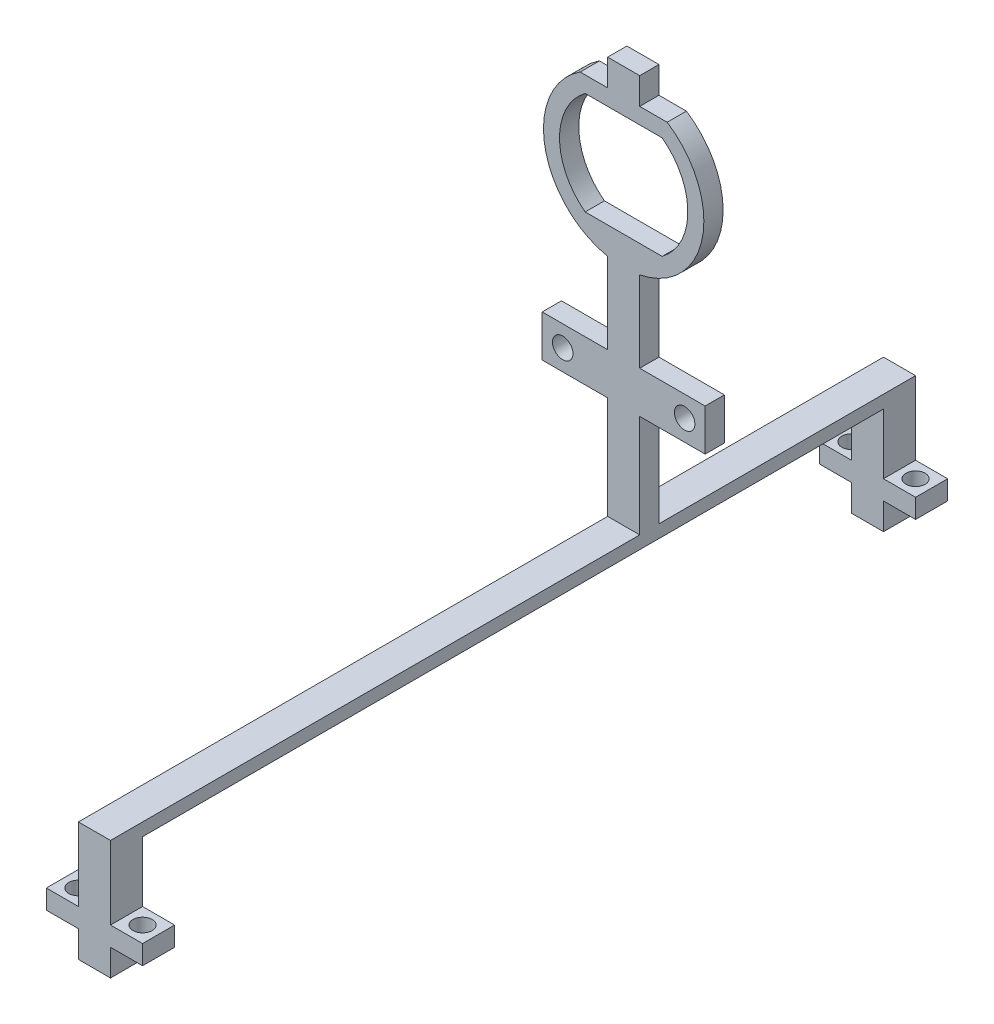
from build123d import *

# Parameters (mm, degrees)
BOSS_EXTRUDE1_DEPTH     = 3
SKETCH3_W               = 25.4
SKETCH3_H               = 6.5
SKETCH3_R               = 1.6
BOSS_EXTRUDE4_DEPTH     = 3
SKETCH11_W              = 5
SKETCH11_H              = 3
BOSS_EXTRUDE8_DEPTH     = 4.15
SKETCH6_W               = 5
SKETCH6_H               = 2
BOSS_EXTRUDE5_DEPTH     = 40
SKETCH10_W              = 5
SKETCH10_H              = 2
BOSS_EXTRUDE7_DEPTH     = 82.49
BOSS_EXTRUDE9_DEPTH     = 5
SKETCH15_R              = 1.5
CUT_EXTRUDE1_DEPTH      = 5
MIRROR2_COPY_1_SKETCH_R = 1.5
MIRROR2_COPY_1_DEPTH    = 5


with BuildPart() as part:
    # Sketch1 → Boss-Extrude1 (new body)
    with BuildSketch(Plane.XY):
        with BuildLine():
            Line((2.5, -49.347448714), (2.5, -12.247448714))
            ThreePointArc((2.5, -12.247448714), (12.284218259, -2.312570382), (6.782329983, 10.5))
            Line((6.782329983, 10.5), (-6.782329983, 10.5))
            ThreePointArc((-6.782329983, 10.5), (-12.284218259, -2.312570382), (-2.5, -12.247448714))
            Line((-2.5, -12.247448714), (-2.5, -49.347448714))
            Line((-2.5, -49.347448714), (2.5, -49.347448714))
        make_face()
        with BuildLine():
            Line((-6, -8), (6, -8))
            ThreePointArc((6, -8), (10, 0), (6, 8))
            Line((6, 8), (-6, 8))
            ThreePointArc((-6, 8), (-10, 0), (-6, -8))
        make_face(mode=Mode.SUBTRACT)
    extrude(amount=BOSS_EXTRUDE1_DEPTH)

    # Sketch3 → Boss-Extrude4 (add)
    with BuildSketch(Plane.XY):
        with Locations((0, -28.097448714)):
            Rectangle(SKETCH3_W, SKETCH3_H)
        with Locations((-9.5, -28.097448714)):
            Circle(SKETCH3_R, mode=Mode.SUBTRACT)
        with Locations(Location((9.5, -28.097448714, 0), (0, 0, 180))):
            Circle(SKETCH3_R, mode=Mode.SUBTRACT)
    extrude(amount=BOSS_EXTRUDE4_DEPTH)

    # Sketch11 → Boss-Extrude8 (add)
    with BuildSketch(Plane(origin=(0, 10.5, 0), x_dir=(1, 0, 0), z_dir=(0, 1, 0))):
        with Locations((0, -1.5)):
            Rectangle(SKETCH11_W, SKETCH11_H)
    extrude(amount=BOSS_EXTRUDE8_DEPTH)

    # Sketch6 → Boss-Extrude5 (add)
    with BuildSketch(Plane(origin=(0, 0, 0), x_dir=(-1, 0, 0), z_dir=(0, 0, -1))):
        with Locations((0, -48.347448714)):
            Rectangle(SKETCH6_W, SKETCH6_H)
    extrude(amount=BOSS_EXTRUDE5_DEPTH)

    # Sketch10 → Boss-Extrude7 (add)
    with BuildSketch(Plane.XY.offset(3)):
        with Locations((0, -48.347448714)):
            Rectangle(SKETCH10_W, SKETCH10_H)
    extrude(amount=BOSS_EXTRUDE7_DEPTH)

    # Sketch14 → Boss-Extrude9 (add)
    with BuildSketch(Plane(origin=(0, 0, -40), x_dir=(-1, 0, 0), z_dir=(0, 0, -1))):
        Polygon((-2.5, -61.767448714), (-2.5, -65.917448714), (2.5, -65.917448714), (2.5, -61.767448714), (7.5, -61.767448714), (7.5, -58.767448714), (2.5, -58.767448714), (2.5, -49.347448714), (-2.5, -49.347448714), (-2.5, -58.767448714), (-7.5, -58.767448714), (-7.5, -61.767448714), align=None)
    boss_extrude9 = extrude(amount=-BOSS_EXTRUDE9_DEPTH)

    # Sketch15 → Cut-Extrude1 (cut)
    with BuildSketch(Plane(origin=(0, -58.767448714, 0), x_dir=(1, 0, 0), z_dir=(0, 1, 0))):
        with Locations(Location((-5, 37.5, 0), (0, 0, 270))):
            Circle(SKETCH15_R)
    cut_extrude1 = extrude(amount=-CUT_EXTRUDE1_DEPTH, mode=Mode.SUBTRACT)

    # Mirror1: Cut-Extrude1 across plane
    add(cut_extrude1.mirror(Plane(origin=(0, 0, 0), x_dir=(0, 0, 1), z_dir=(1, 0, 0))), mode=Mode.SUBTRACT)

    # Mirror2: Boss-Extrude9, Cut-Extrude1 across plane
    add(boss_extrude9.mirror(Plane(origin=(0, 0, 22.745), x_dir=(1, 0, 0), z_dir=(0, 0, -1))))
    add(cut_extrude1.mirror(Plane(origin=(0, 0, 22.745), x_dir=(1, 0, 0), z_dir=(0, 0, -1))), mode=Mode.SUBTRACT)

    # Mirror2 copy 1 sketch → Mirror2 copy 1 (cut)
    with BuildSketch(Plane(origin=(0, -58.767448714, 45.49), x_dir=(-1, 0, 0), z_dir=(0, 1, 0))):
        with Locations(Location((-5, 37.5, 0), (0, 0, 270))):
            Circle(MIRROR2_COPY_1_SKETCH_R)
    extrude(amount=-MIRROR2_COPY_1_DEPTH, mode=Mode.SUBTRACT)


solid = part.part
